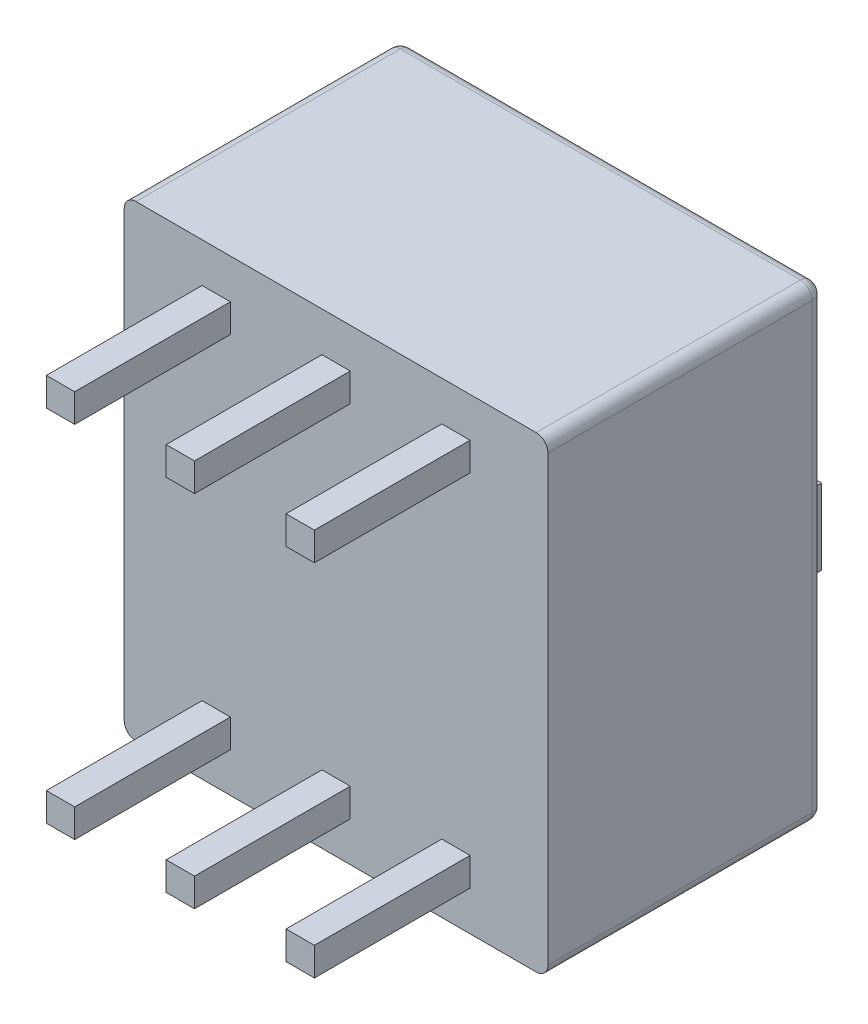
from build123d import *

# Parameters (mm, degrees)
IZIM1_W                       = 8.98
IZIM1_H                       = 9.9
Y_KSEKLIK_EKSTR_ZYON1_DEPTH   = 5.85
IZIM2_W                       = 1.4
IZIM2_H                       = 3.2
KES_EKSTR_ZYON1_DEPTH         = 1
IZIM3_W                       = 1.4
IZIM3_H                       = 1.6
Y_KSEKLIK_EKSTR_ZYON2_DEPTH   = 2.2
IZIM4_W                       = 1.4
IZIM4_H                       = 1.6
Y_KSEKLIK_EKSTR_ZYON3_DEPTH   = 0.9
Y_KSEKLIK_EKSTR_ZYON3_2_DEPTH = 0.9
Y_KSEKLIK_EKSTR_ZYON3_3_DEPTH = 0.9
RADYUS1_R                     = 0.25
IZIM5_W                       = 0.6
IZIM5_H                       = 0.6
Y_KSEKLIK_EKSTR_ZYON4_DEPTH   = 3.3


with BuildPart() as part:
    # Çizim1 → Yükseklik-Ekstrüzyon1 (new body)
    with BuildSketch(Plane.XY):
        Rectangle(IZIM1_W, IZIM1_H)
    extrude(amount=Y_KSEKLIK_EKSTR_ZYON1_DEPTH)

    # Çizim2 → Kes-Ekstrüzyon1 (cut)
    with BuildSketch(Plane(origin=(0, 0, 0), x_dir=(-1, 0, 0), z_dir=(0, 0, -1))):
        with Locations((-2.54, 0)):
            Rectangle(IZIM2_W, IZIM2_H)
        Rectangle(IZIM2_W, IZIM2_H)
        with Locations((2.54, 0)):
            Rectangle(IZIM2_W, IZIM2_H)
    extrude(amount=-KES_EKSTR_ZYON1_DEPTH, mode=Mode.SUBTRACT)

    # Çizim3 → Yükseklik-Ekstrüzyon2 (add)
    with BuildSketch(Plane(origin=(0, 0, 1), x_dir=(-1, 0, 0), z_dir=(0, 0, -1))):
        with Locations((-2.54, -0.8)):
            Rectangle(IZIM3_W, IZIM3_H)
        with Locations((0, -0.8)):
            Rectangle(IZIM3_W, IZIM3_H)
        with Locations((2.54, -0.8)):
            Rectangle(IZIM3_W, IZIM3_H)
    extrude(amount=Y_KSEKLIK_EKSTR_ZYON2_DEPTH)

    # Radyus1
    radyus1_edges = [part.edges().sort_by_distance(p)[0] for p in [
        (0, -4.95, 0),
        (-4.49, 0, 0),
        (0, 4.95, 0),
        (4.49, 0, 0),
        (4.49, -4.95, 2.925),
        (-4.49, -4.95, 2.925),
        (-4.49, 4.95, 2.925),
        (4.49, 4.95, 2.925),
    ]]
    fillet(radyus1_edges, radius=RADYUS1_R)

    # Çizim5 → Yükseklik-Ekstrüzyon4 (add)
    with BuildSketch(Plane.XY.offset(5.85)):
        with Locations((-2.54, -3.81)):
            Rectangle(IZIM5_W, IZIM5_H)
        with Locations((-2.54, 3.81)):
            Rectangle(IZIM5_W, IZIM5_H)
        with Locations((0, -3.81)):
            Rectangle(IZIM5_W, IZIM5_H)
        with Locations((0, 3.81)):
            Rectangle(IZIM5_W, IZIM5_H)
        with Locations((2.54, 3.81)):
            Rectangle(IZIM5_W, IZIM5_H)
        with Locations((2.54, -3.81)):
            Rectangle(IZIM5_W, IZIM5_H)
    extrude(amount=Y_KSEKLIK_EKSTR_ZYON4_DEPTH)


with BuildPart() as body_2:
    # Çizim4 → Yükseklik-Ekstrüzyon3 (new body)
    with BuildSketch(Plane(origin=(0, 0, 1), x_dir=(-1, 0, 0), z_dir=(0, 0, -1))):
        with Locations((-2.54, 0.8)):
            Rectangle(IZIM4_W, IZIM4_H)
    extrude(amount=Y_KSEKLIK_EKSTR_ZYON3_DEPTH)


with BuildPart() as body_3:
    # Çizim4 → Y_kseklik-Ekstr_zyon3 2 (new body)
    with BuildSketch(Plane(origin=(0, 0, 1), x_dir=(-1, 0, 0), z_dir=(0, 0, -1))):
        with Locations((0, 0.8)):
            Rectangle(IZIM4_W, IZIM4_H)
    extrude(amount=Y_KSEKLIK_EKSTR_ZYON3_2_DEPTH)


with BuildPart() as body_4:
    # Çizim4 → Y_kseklik-Ekstr_zyon3 3 (new body)
    with BuildSketch(Plane(origin=(0, 0, 1), x_dir=(-1, 0, 0), z_dir=(0, 0, -1))):
        with Locations((2.54, 0.8)):
            Rectangle(IZIM4_W, IZIM4_H)
    extrude(amount=Y_KSEKLIK_EKSTR_ZYON3_3_DEPTH)


solid = Compound([part.part, body_2.part, body_3.part, body_4.part])
